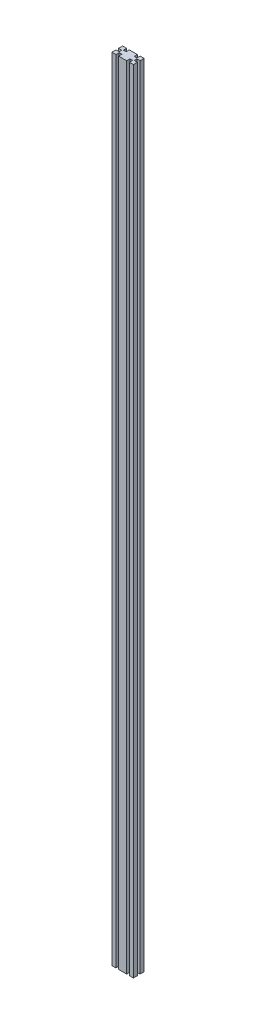
from build123d import *

# Parameters (mm, degrees)
BOSS_EXTRUDE1_DEPTH      = 736.6
BOSS_EXTRUDE1_DEPTH_BACK = 736.6
SKETCH1_W                = 40
SKETCH1_H                = 20
CUT_EXTRUDE1_DEPTH       = 737.939319076
CUT_EXTRUDE1_DEPTH_BACK  = 737.939319076
SKETCH2_W                = 5
SKETCH2_H                = 12
SKETCH2_W_2              = 12
SKETCH2_H_2              = 5


with BuildPart() as part:
    # Sketch1 → Boss-Extrude1 (new, two sides: drawn at the far end of the back side and taken through both)
    with BuildSketch(Plane(origin=(0, 0, 0), x_dir=(1, 0, 0), z_dir=(0, 1, 0)).offset(-BOSS_EXTRUDE1_DEPTH_BACK)):
        Rectangle(SKETCH1_W, SKETCH1_H)
    extrude(amount=BOSS_EXTRUDE1_DEPTH + BOSS_EXTRUDE1_DEPTH_BACK)

    # Sketch2 → Cut-Extrude1 (cut, two sides: drawn at the far end of the back side and taken through both)
    with BuildSketch(Plane(origin=(0, 0, 0), x_dir=(1, 0, 0), z_dir=(0, 1, 0)).offset(-CUT_EXTRUDE1_DEPTH_BACK)):
        with Locations((-10, 10)):
            Rectangle(SKETCH2_W, SKETCH2_H)
        with Locations((-20, 0)):
            Rectangle(SKETCH2_W_2, SKETCH2_H_2)
        with Locations((-10, -10)):
            Rectangle(SKETCH2_W, SKETCH2_H)
        with Locations((10, -10)):
            Rectangle(SKETCH2_W, SKETCH2_H)
        with Locations((20, 0)):
            Rectangle(SKETCH2_W_2, SKETCH2_H_2)
        with Locations((10, 10)):
            Rectangle(SKETCH2_W, SKETCH2_H)
    extrude(amount=CUT_EXTRUDE1_DEPTH + CUT_EXTRUDE1_DEPTH_BACK, mode=Mode.SUBTRACT)


solid = part.part
